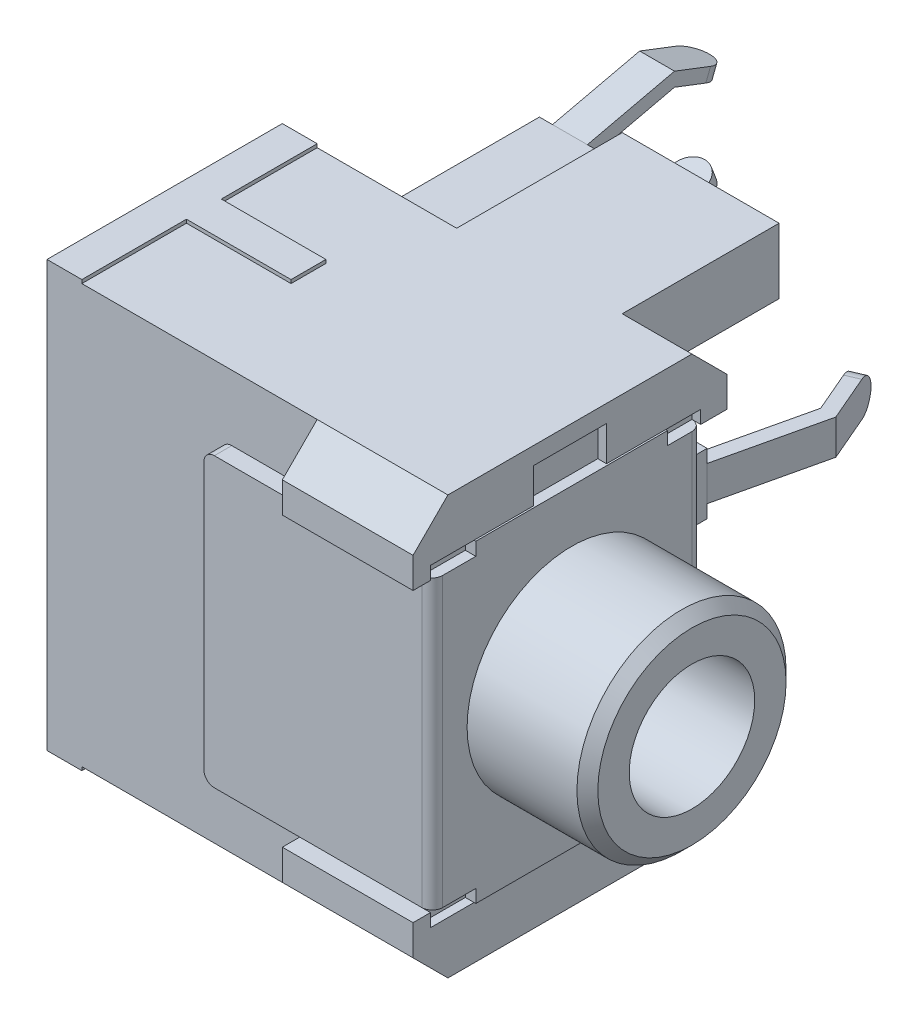
from build123d import *

# Parameters (mm, degrees)
EXTRUDE1_DEPTH               = 6
EXTRUDE1_DEPTH_BACK          = 6
SKETCH4_W                    = 11.5
SKETCH4_H                    = 9
SKETCH5_R                    = 3
EXTRUDE2_DEPTH               = 0.5
SKETCH6_R                    = 3
EXTRUDE3_DEPTH               = 3
SKETCH12_R                   = 1.8
CUT_EXTRUDE1_DEPTH           = 3.5
CHAMFER1_SIZE                = 0.3
CUT_EXTRUDE17_DEPTH          = 1
CUT_EXTRUDE18_DEPTH          = 1.25
SKETCH89_R                   = 0.5
EXTRUDE44_DEPTH              = 3.75
SKETCH58_W                   = 4.5
SKETCH58_H                   = 1.875
EXTRUDE45_DEPTH              = 4.75
EXTRUDE46_DEPTH              = 0.5
FILLET34_RADIUS              = 0.5
FILLET34_LENGTH              = 0.4
EXTRUDE67_DEPTH              = 0.5
EXTRUDE67_DEPTH_BACK         = 0.5
SKETCH127_W                  = 1.5
SKETCH127_H                  = 1
FILLET53_R                   = 0.3
EXTRUDE73_DEPTH              = 0.5
EXTRUDE73_2_DEPTH            = 0.5
EXTRUDE68_DEPTH              = 0.5
EXTRUDE68_DEPTH_BACK         = 6.25
SKETCH128_W                  = 6.55
SKETCH128_H                  = 8.25
FILLET52_R                   = 0.3
EXTRUDE49_DEPTH              = 0.375
EXTRUDE49_DEPTH_BACK         = 1.375
SKETCH90_W                   = 0.435427517
SKETCH90_H                   = 3.25
EXTRUDE47_DEPTH              = 0.5
FILLET35_RADIUS              = 0.5
FILLET35_LENGTH              = 0.373317609
EXTRUDE50_START              = -1.375
SKETCH91_W                   = 4.75
SKETCH91_H                   = 0.4
EXTRUDE50_DEPTH              = 1.75
FILLET35_OF_MIRROR4_2_RADIUS = 0.5
FILLET35_OF_MIRROR4_2_LENGTH = 0.373317609
FILLET35_OF_MIRROR5_2_RADIUS = 0.5
FILLET35_OF_MIRROR5_2_LENGTH = 0.373317609
SKETCH65_W                   = 1
SKETCH65_H                   = 0.4
EXTRUDE48_DEPTH              = 7.25
FILLET36_RADIUS              = 0.5
FILLET36_LENGTH              = 0.4
EXTRUDE51_DEPTH              = 0.375
EXTRUDE51_DEPTH_BACK         = 1.375
SKETCH93_W                   = 3.25
SKETCH93_H                   = 0.4
T_EXTRUSION_DEPTH            = 0.1
SKETCH143_W                  = 7.75
SKETCH143_H                  = 0.375
FRONT_CUT_DEPTH              = 0.25
SKETCH144_W                  = 5.5
SKETCH144_H                  = 0.375
WIDEN_METAL_DEPTH            = 11.55
SKETCH145_W                  = 2.1
SKETCH145_H                  = 1
CUT_EXTRUDE19_DEPTH          = 0.25
FRONT_CHAMFER_SIZE           = 1


with BuildPart() as part:
    # Sketch4 → Extrude1 (new, two sides: drawn at the far end of the back side and taken through both)
    with BuildSketch(Plane(origin=(0, 0, 0), x_dir=(1, 0, 0), z_dir=(0, 1, 0)).offset(-EXTRUDE1_DEPTH_BACK)):
        with Locations((-9.25, 0)):
            Rectangle(SKETCH4_W, SKETCH4_H)
    extrude(amount=EXTRUDE1_DEPTH + EXTRUDE1_DEPTH_BACK)

    # Sketch5 → Extrude2 (add)
    with BuildSketch(Plane(origin=(-3.5, 0, 0), x_dir=(0, 0, -1), z_dir=(1, 0, 0))):
        with Locations(Location((0, 0, 0), (0, 0, 180))):
            Circle(SKETCH5_R)
    extrude(amount=EXTRUDE2_DEPTH)

    # Sketch6 → Extrude3 (add)
    with BuildSketch(Plane(origin=(-3, 0, 0), x_dir=(0, 0, -1), z_dir=(1, 0, 0))):
        with Locations(Location((0, 0, 0), (0, 0, 180))):
            Circle(SKETCH6_R)
    extrude(amount=EXTRUDE3_DEPTH)

    # Sketch12 → Cut-Extrude1 (cut)
    with BuildSketch(Plane(origin=(0, 0, 0), x_dir=(0, 0, -1), z_dir=(1, 0, 0))):
        Circle(SKETCH12_R)
    extrude(amount=-CUT_EXTRUDE1_DEPTH, mode=Mode.SUBTRACT)

    # Chamfer1
    chamfer1_edges = [part.edges().sort_by_distance(p)[0] for p in [
        (0, 0, -3),
    ]]
    chamfer(chamfer1_edges, length=CHAMFER1_SIZE)

    # Sketch54 → Cut-Extrude17 (cut)
    with BuildSketch(Plane.XY.offset(4.5)):
        Polygon((-15, 6), (-7.25, 6), (-7.25, 4.125), (-3.5, 4.125), (-3.5, -4.125), (-7.25, -4.125), (-7.25, -6), (-15, -6), align=None)
    extrude(amount=-CUT_EXTRUDE17_DEPTH, mode=Mode.SUBTRACT)

    # Sketch56 → Cut-Extrude18 (cut)
    with BuildSketch(Plane(origin=(0, 0, -4.5), x_dir=(-1, 0, 0), z_dir=(0, 0, -1))):
        Polygon((15, 6), (7.25, 6), (7.25, 4.125), (3.5, 4.125), (3.5, -4.125), (7.25, -4.125), (7.25, -6), (15, -6), align=None)
    extrude(amount=-CUT_EXTRUDE18_DEPTH, mode=Mode.SUBTRACT)

    # Sketch89 → Extrude44 (add)
    with BuildSketch(Plane(origin=(0, 0, -3.25), x_dir=(-1, 0, 0), z_dir=(0, 0, -1))):
        with Locations(Location((6.5, 5, 0), (0, 0, 180))):
            Circle(SKETCH89_R)
        with Locations(Location((6.5, -5, 0), (0, 0, 180))):
            Circle(SKETCH89_R)
        with Locations((11.5, 0)):
            Circle(SKETCH89_R)
    extrude(amount=EXTRUDE44_DEPTH)

    # Sketch58 → Extrude45 (add)
    with BuildSketch(Plane(origin=(0, 0, -3.25), x_dir=(-1, 0, 0), z_dir=(0, 0, -1))):
        with Locations((7.75, 5.0625)):
            Rectangle(SKETCH58_W, SKETCH58_H)
        with Locations((7.75, -5.0625)):
            Rectangle(SKETCH58_W, SKETCH58_H)
    extrude(amount=EXTRUDE45_DEPTH)

    # Sketch63 → Extrude46 (add, symmetric)
    with BuildSketch(Plane(origin=(0, 0, 0), x_dir=(1, 0, 0), z_dir=(0, 1, 0))):
        Polygon((-6.064572483, 6.5), (-5.371967909, 9.5), (-6.132545042, 11.268391866), (-6.5, 11.110351194), (-5.807395427, 9.5), (-6.5, 6.5), (-6.5, 3.25), (-6.064572483, 3.25), align=None)
    extrude(amount=EXTRUDE46_DEPTH, both=True)

    # Fillet34: full round fillet: the end face becomes a half cylinder, R = half its width
    fillet34_face = Plane((-6.316272521, 0, -11.18937153), x_dir=(-0.918637394769, 0, 0.395101679233), z_dir=(-0.395101679233, 0, -0.918637394769))  # on the end face: x along it, z out of the body
    fillet34_slab = fillet34_face.offset(-FILLET34_RADIUS / 2) * Box(FILLET34_LENGTH, 2 * FILLET34_RADIUS, FILLET34_RADIUS, mode=Mode.PRIVATE)  # the body's end, R deep
    fillet34_round = Plane((-6.118721681, 0, -10.730052833), x_dir=(-0.395101679233, 0, -0.918637394769), z_dir=(-0.918637394769, 0, 0.395101679233)) * Cylinder(FILLET34_RADIUS, FILLET34_LENGTH, mode=Mode.PRIVATE)  # its axis R under the face
    add(fillet34_slab - fillet34_round, mode=Mode.SUBTRACT)

    # Sketch90 → Extrude49 (add, two sides: drawn at the far end of the back side and taken through both)
    with BuildSketch(Plane(origin=(0, 0.5, 0), x_dir=(-1, 0, 0), z_dir=(0, 1, 0)).offset(-EXTRUDE49_DEPTH_BACK)):
        with Locations((6.282286241, -4.875)):
            Rectangle(SKETCH90_W, SKETCH90_H)
    extrude(amount=EXTRUDE49_DEPTH + EXTRUDE49_DEPTH_BACK)

    # Sketch64 → Extrude47 (add, symmetric)
    with BuildSketch(Plane(origin=(-11.5, 0, 0), x_dir=(0, 0, -1), z_dir=(1, 0, 0))):
        Polygon((3.25, 5.2), (8, 5.2), (10.5, 5.777170478), (12, 5.2), (11.86593673, 4.851584908), (10.5, 5.377170478), (8, 4.8), (3.25, 4.8), align=None)
    extrude47 = extrude(amount=EXTRUDE47_DEPTH, both=True)

    # Fillet35: full round fillet: the end face becomes a half cylinder, R = half its width
    fillet35_face = Plane((-11.5, 5.025792454, -11.932968365), x_dir=(0, 0.933294021466, -0.359113170874), z_dir=(0, -0.359113170874, -0.933294021466))  # on the end face: x along it, z out of the body
    fillet35_slab = fillet35_face.offset(-FILLET35_RADIUS / 2) * Box(FILLET35_LENGTH, 2 * FILLET35_RADIUS, FILLET35_RADIUS, mode=Mode.PRIVATE)  # the body's end, R deep
    fillet35_round = Plane((-11.5, 5.205349039, -11.466321354), x_dir=(0, -0.359113170874, -0.933294021466), z_dir=(0, 0.933294021466, -0.359113170874)) * Cylinder(FILLET35_RADIUS, FILLET35_LENGTH, mode=Mode.PRIVATE)  # its axis R under the face
    add(fillet35_slab - fillet35_round, mode=Mode.SUBTRACT)

    # Sketch91 → Extrude50 (add)
    with BuildSketch(Plane.ZY.offset(12).offset(EXTRUDE50_START)):
        with Locations((-5.625, 5)):
            Rectangle(SKETCH91_W, SKETCH91_H)
    extrude50 = extrude(amount=EXTRUDE50_DEPTH)

    # Mirror4: Extrude47, Extrude50 across plane
    add(extrude47.mirror(Plane.ZX))
    add(extrude50.mirror(Plane.ZX))

    # Fillet35 of Mirror4 2: full round fillet: the end face becomes a half cylinder, R = half its width
    fillet35_of_mirror4_2_face = Plane((-11.5, -5.025792454, -11.932968365), x_dir=(0, -0.933294021466, -0.359113170874), z_dir=(0, 0.359113170874, -0.933294021466))  # on the end face: x along it, z out of the body
    fillet35_of_mirror4_2_slab = fillet35_of_mirror4_2_face.offset(-FILLET35_OF_MIRROR4_2_RADIUS / 2) * Box(FILLET35_OF_MIRROR4_2_LENGTH, 2 * FILLET35_OF_MIRROR4_2_RADIUS, FILLET35_OF_MIRROR4_2_RADIUS, mode=Mode.PRIVATE)  # the body's end, R deep
    fillet35_of_mirror4_2_round = Plane((-11.5, -5.205349039, -11.466321354), x_dir=(0, 0.359113170874, -0.933294021466), z_dir=(0, -0.933294021466, -0.359113170874)) * Cylinder(FILLET35_OF_MIRROR4_2_RADIUS, FILLET35_OF_MIRROR4_2_LENGTH, mode=Mode.PRIVATE)  # its axis R under the face
    add(fillet35_of_mirror4_2_slab - fillet35_of_mirror4_2_round, mode=Mode.SUBTRACT)

    # Mirror5: Extrude47, Extrude50 across plane
    add(extrude47.mirror(Plane.ZX.offset(3.75)))
    add(extrude50.mirror(Plane.ZX.offset(3.75)))

    # Fillet35 of Mirror5 2: full round fillet: the end face becomes a half cylinder, R = half its width
    fillet35_of_mirror5_2_face = Plane((-11.5, 2.474207546, -11.932968365), x_dir=(0, -0.933294021466, -0.359113170874), z_dir=(0, 0.359113170874, -0.933294021466))  # on the end face: x along it, z out of the body
    fillet35_of_mirror5_2_slab = fillet35_of_mirror5_2_face.offset(-FILLET35_OF_MIRROR5_2_RADIUS / 2) * Box(FILLET35_OF_MIRROR5_2_LENGTH, 2 * FILLET35_OF_MIRROR5_2_RADIUS, FILLET35_OF_MIRROR5_2_RADIUS, mode=Mode.PRIVATE)  # the body's end, R deep
    fillet35_of_mirror5_2_round = Plane((-11.5, 2.294650961, -11.466321354), x_dir=(0, 0.359113170874, -0.933294021466), z_dir=(0, -0.933294021466, -0.359113170874)) * Cylinder(FILLET35_OF_MIRROR5_2_RADIUS, FILLET35_OF_MIRROR5_2_LENGTH, mode=Mode.PRIVATE)  # its axis R under the face
    add(fillet35_of_mirror5_2_slab - fillet35_of_mirror5_2_round, mode=Mode.SUBTRACT)

    # Sketch65 → Extrude48 (add)
    with BuildSketch(Plane(origin=(0, 0, -3.25), x_dir=(-1, 0, 0), z_dir=(0, 0, -1))):
        with Locations((11.5, -2.5)):
            Rectangle(SKETCH65_W, SKETCH65_H)
    extrude(amount=EXTRUDE48_DEPTH)

    # Fillet36: full round fillet: the end face becomes a half cylinder, R = half its width
    fillet36_face = Plane((-11.5, -2.5, -10.5), x_dir=(0, -1, 0), z_dir=(0, 0, -1))  # on the end face: x along it, z out of the body
    fillet36_slab = fillet36_face.offset(-FILLET36_RADIUS / 2) * Box(FILLET36_LENGTH, 2 * FILLET36_RADIUS, FILLET36_RADIUS, mode=Mode.PRIVATE)  # the body's end, R deep
    fillet36_round = Plane((-11.5, -2.5, -10), x_dir=(0, 0, -1), z_dir=(0, -1, 0)) * Cylinder(FILLET36_RADIUS, FILLET36_LENGTH, mode=Mode.PRIVATE)  # its axis R under the face
    add(fillet36_slab - fillet36_round, mode=Mode.SUBTRACT)

    # Sketch93 → Extrude51 (add, two sides: drawn at the far end of the back side and taken through both)
    with BuildSketch(Plane.ZY.offset(12).offset(-EXTRUDE51_DEPTH_BACK)):
        with Locations((-4.875, -2.5)):
            Rectangle(SKETCH93_W, SKETCH93_H)
    extrude(amount=EXTRUDE51_DEPTH + EXTRUDE51_DEPTH_BACK)

    # Sketch142 → T-EXTRUSION (add)
    with BuildSketch(Plane(origin=(0, 6, 0), x_dir=(-1, 0, 0), z_dir=(0, 1, 0))):
        Polygon((15, -3.25), (14, -3.25), (14, -0.5), (11, -0.5), (11, 0.5), (14, 0.5), (14, 3.5), (15, 3.5), align=None)
    t_extrusion = extrude(amount=T_EXTRUSION_DEPTH)

    # T-MIRRORED: T-EXTRUSION across plane
    add(t_extrusion.mirror(Plane.ZX))

    # Sketch143 → FRONT_CUT (cut)
    with BuildSketch(Plane(origin=(-3.5, 0, 0), x_dir=(0, 0, -1), z_dir=(1, 0, 0))):
        with Locations((-0.125, 4.3125)):
            Rectangle(SKETCH143_W, SKETCH143_H)
        with Locations((-0.125, -4.3125)):
            Rectangle(SKETCH143_W, SKETCH143_H)
    extrude(amount=-FRONT_CUT_DEPTH, mode=Mode.SUBTRACT)



with BuildPart() as body_2:
    # Sketch127 → Extrude67 (new, two sides: drawn at the far end of the back side and taken through both)
    with BuildSketch(Plane(origin=(0, 0, -3.25), x_dir=(-1, 0, 0), z_dir=(0, 0, -1)).offset(-EXTRUDE67_DEPTH_BACK)):
        Polygon((3.45, 4.125), (3.45, -4.125), (10, -4.125), (10, -1), (6.5, -1), (6.5, 1), (10, 1), (10, 4.125), align=None)
        with Locations((8.25, 2.5625)):
            Rectangle(SKETCH127_W, SKETCH127_H, mode=Mode.SUBTRACT)
        with Locations((8.25, -2.5625)):
            Rectangle(SKETCH127_W, SKETCH127_H, mode=Mode.SUBTRACT)
    extrude(amount=EXTRUDE67_DEPTH + EXTRUDE67_DEPTH_BACK)

    # Fillet53
    fillet53_edges = [body_2.edges().sort_by_distance(p)[0] for p in [
        (-10, 4.125, -3.25),
        (-10, 1, -3.25),
        (-6.5, 1, -3.25),
        (-6.5, -1, -3.25),
        (-10, -1, -3.25),
        (-10, -4.125, -3.25),
        (-7.5, 3.0625, -3.25),
        (-7.5, 2.0625, -3.25),
        (-9, 2.0625, -3.25),
        (-9, 3.0625, -3.25),
        (-7.5, -2.0625, -3.25),
        (-7.5, -3.0625, -3.25),
        (-9, -3.0625, -3.25),
        (-9, -2.0625, -3.25),
        (-3.45, 0, -3.75),
    ]]
    fillet(fillet53_edges, radius=FILLET53_R)


with BuildPart() as body_3:
    # Sketch141 → Extrude73 (new body)
    with BuildSketch(Plane(origin=(0, 0, -3.25), x_dir=(-1, 0, 0), z_dir=(0, 0, -1))):
        with BuildLine():
            Line((7.5, -2.3625), (7.5, -2.7625))
            ThreePointArc((7.5, -2.7625), (7.587867966, -2.974632034), (7.8, -3.0625))
            Line((7.8, -3.0625), (8.7, -3.0625))
            ThreePointArc((8.7, -3.0625), (8.912132034, -2.974632034), (9, -2.7625))
            Line((9, -2.7625), (9, -2.3625))
            ThreePointArc((9, -2.3625), (8.912132034, -2.150367966), (8.7, -2.0625))
            Line((8.7, -2.0625), (7.8, -2.0625))
            ThreePointArc((7.8, -2.0625), (7.587867966, -2.150367966), (7.5, -2.3625))
        make_face()
    extrude(amount=EXTRUDE73_DEPTH)


with BuildPart() as body_4:
    # Sketch141 → Extrude73 2 (new body)
    with BuildSketch(Plane(origin=(0, 0, -3.25), x_dir=(-1, 0, 0), z_dir=(0, 0, -1))):
        with BuildLine():
            Line((9, 2.3625), (9, 2.7625))
            ThreePointArc((9, 2.7625), (8.912132034, 2.974632034), (8.7, 3.0625))
            Line((8.7, 3.0625), (7.8, 3.0625))
            ThreePointArc((7.8, 3.0625), (7.587867966, 2.974632034), (7.5, 2.7625))
            Line((7.5, 2.7625), (7.5, 2.3625))
            ThreePointArc((7.5, 2.3625), (7.587867966, 2.150367966), (7.8, 2.0625))
            Line((7.8, 2.0625), (8.7, 2.0625))
            ThreePointArc((8.7, 2.0625), (8.912132034, 2.150367966), (9, 2.3625))
        make_face()
    extrude(amount=EXTRUDE73_2_DEPTH)


with BuildPart() as body_5:
    # Sketch128 → Extrude68 (new, two sides: drawn at the far end of the back side and taken through both)
    with BuildSketch(Plane.XY.offset(3.5).offset(-EXTRUDE68_DEPTH_BACK)):
        with Locations((-6.725, 0)):
            Rectangle(SKETCH128_W, SKETCH128_H)
    extrude(amount=EXTRUDE68_DEPTH + EXTRUDE68_DEPTH_BACK)

    # Fillet52
    fillet52_edges = [body_5.edges().sort_by_distance(p)[0] for p in [
        (-3.45, 0, 4),
        (-10, 4.125, 0.625),
        (-10, -4.125, 0.625),
    ]]
    fillet(fillet52_edges, radius=FILLET52_R)


with BuildPart() as part_1:
    add(part.part)

    add(body_2.part)  # WIDEN_METAL merges body 2

    add(body_5.part)  # WIDEN_METAL merges body 5
    # Sketch144 → WIDEN_METAL (add)
    with BuildSketch(Plane(origin=(-3.45, 0, 0), x_dir=(0, 0, -1), z_dir=(1, 0, 0))):
        with Locations((0, 4.3125)):
            Rectangle(SKETCH144_W, SKETCH144_H)
        with Locations((0, -4.3125)):
            Rectangle(SKETCH144_W, SKETCH144_H)
    extrude(amount=-WIDEN_METAL_DEPTH)

    # Sketch145 → Cut-Extrude19 (cut)
    with BuildSketch(Plane(origin=(-3.5, 0, 0), x_dir=(0, 0, -1), z_dir=(1, 0, 0))):
        with Locations((0, 5)):
            Rectangle(SKETCH145_W, SKETCH145_H)
    extrude(amount=-CUT_EXTRUDE19_DEPTH, mode=Mode.SUBTRACT)

    # FRONT_CHAMFER
    front_chamfer_edges = [part_1.edges().sort_by_distance(p)[0] for p in [
        (-4.5, 6, -4.5),
        (-5.375, 6, 4.5),
        (-4.5, -6, -4.5),
        (-5.375, -6, 4.5),
    ]]
    chamfer(front_chamfer_edges, length=FRONT_CHAMFER_SIZE)


solid = Compound([body_3.part, body_4.part, part_1.part])
